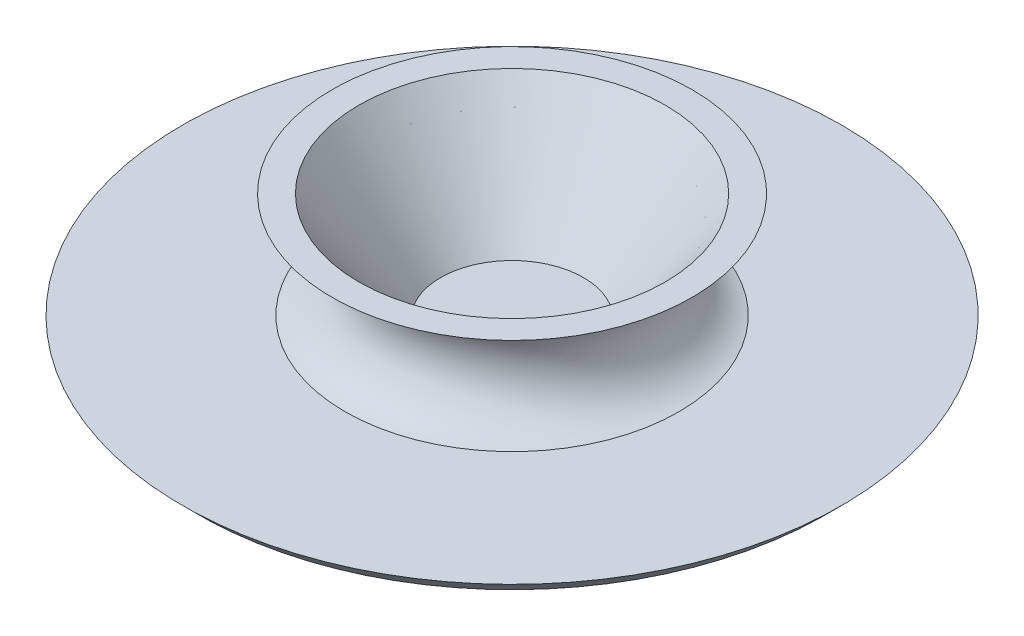
from build123d import *

# Parameters (mm, degrees)
SKETCH3_R          = 35.304496673
CUT_EXTRUDE2_DEPTH = 25
CUT_EXTRUDE2_DRAFT = -37


with BuildPart() as part:
    # Sketch1 → Revolve1 (revolve)
    with BuildSketch(Plane.XY, mode=Mode.PRIVATE) as revolve1_sk:
        Polygon((0, 0), (-23.668379582, 0), (-27.829852915, 4.161473333), (-72.305599163, 4.161473333), (-75.946888329, 7.8027625), (0, 7.8027625), align=None)
    revolve(revolve1_sk.sketch.rotate(Axis((0, 0, 0), (0, 1, 0)), 270), axis=Axis((0, 0, 0), (0, 1, 0)))

    # Sketch2 → Revolve2 (revolve)
    with BuildSketch(Plane.XY, mode=Mode.PRIVATE) as revolve2_sk:
        with BuildLine():
            Line((-41.476502692, 32.102501356), (0, 32.102501356))
            Line((0, 32.102501356), (0, 7.8027625))
            Line((0, 7.8027625), (-38.491451362, 7.8027625))
            ThreePointArc((-38.491451362, 7.8027625), (-29.235303405, 21.273030582), (-41.476502692, 32.102501356))
        make_face()
    revolve(revolve2_sk.sketch.rotate(Axis((0, 0, 0), (0, 1, 0)), 270), axis=Axis((0, 0, 0), (0, 1, 0)))


with BuildPart() as cut_extrude2_tool:
    # Sketch3 → Cut-Extrude2 (with draft: the straight prism first)
    with BuildSketch(Plane(origin=(0, 32.102501356, 0), x_dir=(1, 0, 0), z_dir=(0, 1, 0))):
        Circle(SKETCH3_R)
    extrude(amount=-CUT_EXTRUDE2_DEPTH)
    # Cut-Extrude2: the draft: its side faces are tilted about the plane it starts from
    cut_extrude2_sides = [cut_extrude2_tool.faces().sort_by_distance(p)[0] for p in [
        (-35.304496673, 19.602501356, 0),
    ]]
    draft(cut_extrude2_sides, Plane(origin=(0, 32.102501356, 0), x_dir=(1, 0, 0), z_dir=(0, 1, 0)), CUT_EXTRUDE2_DRAFT)


with BuildPart() as part_1:
    add(part.part)

    # Cut-Extrude2: cut by cut_extrude2_tool
    add(cut_extrude2_tool.part, mode=Mode.SUBTRACT)


solid = part_1.part
